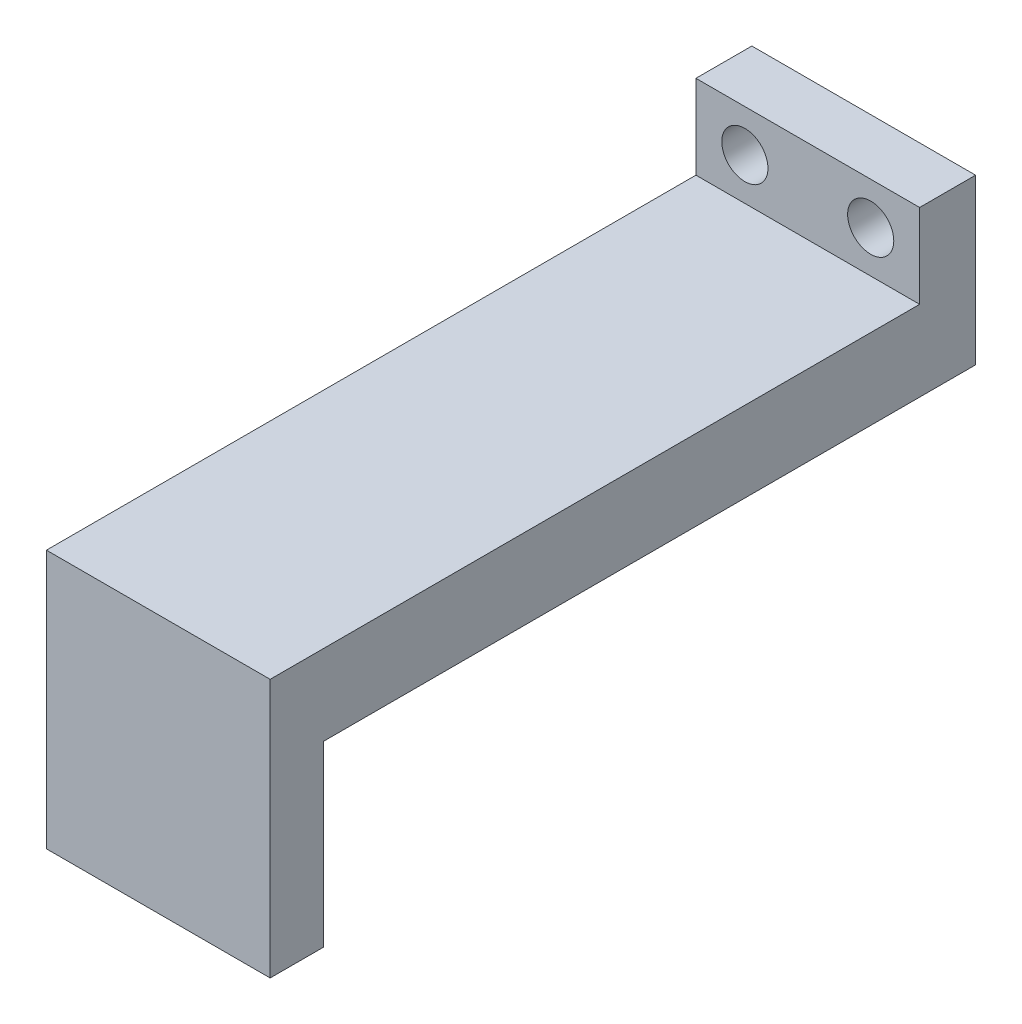
from build123d import *

# Parameters (mm, degrees)
BRACKET_FOOT_PROFILE_W                    = 16
BRACKET_FOOT_PROFILE_H                    = 11.75
BRACKET_FOOT_DEPTH                        = 4
UPRIGHT_START                             = 4
UPRIGHT_PROFILE_W                         = 16
UPRIGHT_PROFILE_H                         = 5.75
UPRIGHT_DEPTH                             = 46.45
UPPER_START                               = 46.65
UPPER_ARM_PROFILE_W                       = 16
UPPER_ARM_PROFILE_H                       = 13.2
UPPER_ARM_DEPTH                           = 3.8
BRACKET_START                             = -0.1
BRACKET_BOLT_CLEARANCES_PROFILE_R         = 1.65
BRACKET_BOLT_CLEARANCES_DEPTH             = 4.2
INTEGRAL_START                            = 43.35
INTEGRAL_STOP_PIN_DIAMETER_4_MM_PROFILE_R = 2
INTEGRAL_STOP_PIN_DIAMETER_4_MM_DEPTH     = 3.5


with BuildPart() as part:
    # Bracket foot profile → Bracket foot (new body)
    with BuildSketch(Plane.XY):
        with Locations((0, 33.125)):
            Rectangle(BRACKET_FOOT_PROFILE_W, BRACKET_FOOT_PROFILE_H)
    extrude(amount=BRACKET_FOOT_DEPTH)

    # Upright profile → Upright (add)
    with BuildSketch(Plane.XY.offset(UPRIGHT_START)):
        with Locations((0, 30.125)):
            Rectangle(UPRIGHT_PROFILE_W, UPRIGHT_PROFILE_H)
    extrude(amount=UPRIGHT_DEPTH)

    # Upper arm profile → Upper arm (add)
    with BuildSketch(Plane.XY.offset(UPPER_START)):
        with Locations((0, 21.1)):
            Rectangle(UPPER_ARM_PROFILE_W, UPPER_ARM_PROFILE_H)
    extrude(amount=UPPER_ARM_DEPTH)

    # Bracket bolt clearances profile → Bracket bolt clearances (cut)
    with BuildSketch(Plane.XY.offset(BRACKET_START)):
        with Locations((-4.5, 36)):
            Circle(BRACKET_BOLT_CLEARANCES_PROFILE_R)
        with Locations((4.5, 36)):
            Circle(BRACKET_BOLT_CLEARANCES_PROFILE_R)
    extrude(amount=BRACKET_BOLT_CLEARANCES_DEPTH, mode=Mode.SUBTRACT)

    # Integral stop pin diameter 4 mm profile → Integral stop pin diameter 4 mm (add)
    with BuildSketch(Plane.XY.offset(INTEGRAL_START)):
        with Locations((0, 17)):
            Circle(INTEGRAL_STOP_PIN_DIAMETER_4_MM_PROFILE_R)
    extrude(amount=INTEGRAL_STOP_PIN_DIAMETER_4_MM_DEPTH)


solid = part.part
